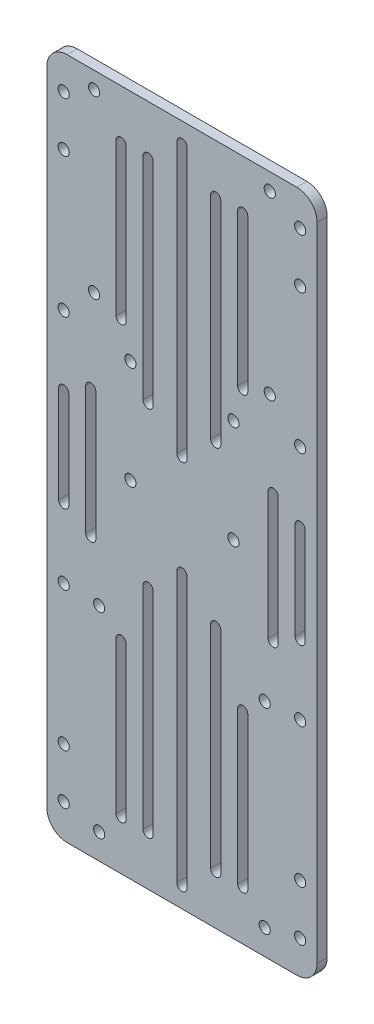
from build123d import *

# Parameters (mm, degrees)
SKETCH_1_R          = 1.65
EXTRUDE_1_DEPTH     = 3
SKETCH_3_R          = 1.65
CUT_EXTRUDE_2_DEPTH = 109.673823895
SKETCH_4_R          = 1.65
CUT_EXTRUDE_3_DEPTH = 109.673823895
CUT_EXTRUDE_4_DEPTH = 109.673823895


with BuildPart() as part:
    # Эскиз1 → Бобышка-Вытянуть1 (new body)
    with BuildSketch(Plane.XY):
        with BuildLine():
            Line((-34, 101), (34, 101))
            ThreePointArc((34, 101), (38.242640687, 99.242640687), (40, 95))
            Line((40, 95), (40, -95))
            ThreePointArc((40, -95), (38.242640687, -99.242640687), (34, -101))
            Line((34, -101), (-34, -101))
            ThreePointArc((-34, -101), (-38.242640687, -99.242640687), (-40, -95))
            Line((-40, -95), (-40, 95))
            ThreePointArc((-40, 95), (-38.242640687, 99.242640687), (-34, 101))
        make_face()
        with Locations((-35, 91)):
            Circle(SKETCH_1_R, mode=Mode.SUBTRACT)
        with Locations((-35, 35)):
            Circle(SKETCH_1_R, mode=Mode.SUBTRACT)
        with Locations(Location((35, 35, 0), (0, 0, 180))):
            Circle(SKETCH_1_R, mode=Mode.SUBTRACT)
        with Locations(Location((35, 91, 0), (0, 0, 180))):
            Circle(SKETCH_1_R, mode=Mode.SUBTRACT)
        with Locations((35, -91)):
            Circle(SKETCH_1_R, mode=Mode.SUBTRACT)
        with Locations(Location((-35, -91, 0), (0, 0, 180))):
            Circle(SKETCH_1_R, mode=Mode.SUBTRACT)
        with Locations(Location((-35, -35, 0), (0, 0, 180))):
            Circle(SKETCH_1_R, mode=Mode.SUBTRACT)
        with Locations((35, -35)):
            Circle(SKETCH_1_R, mode=Mode.SUBTRACT)
    extrude(amount=EXTRUDE_1_DEPTH)

    # Эскиз3 → Вырез-Вытянуть2 (cut, through all)
    with BuildSketch(Plane.XY.offset(3)):
        with Locations((-24.5, -93.5)):
            Circle(SKETCH_3_R)
        with Locations((-24.5, -35.5)):
            Circle(SKETCH_3_R)
        with Locations((-15.25, 1.25)):
            Circle(SKETCH_3_R)
        with Locations((-15.25, 31.75)):
            Circle(SKETCH_3_R)
        with Locations((-26, 44)):
            Circle(SKETCH_3_R)
        with Locations((-26, 96)):
            Circle(SKETCH_3_R)
        with Locations(Location((24.5, -93.5, 0), (0, 0, 180))):
            Circle(SKETCH_3_R)
        with Locations(Location((24.5, -35.5, 0), (0, 0, 180))):
            Circle(SKETCH_3_R)
        with Locations(Location((15.25, 1.25, 0), (0, 0, 180))):
            Circle(SKETCH_3_R)
        with Locations(Location((15.25, 31.75, 0), (0, 0, 180))):
            Circle(SKETCH_3_R)
        with Locations(Location((26, 44, 0), (0, 0, 180))):
            Circle(SKETCH_3_R)
        with Locations(Location((26, 96, 0), (0, 0, 180))):
            Circle(SKETCH_3_R)
    extrude(amount=-CUT_EXTRUDE_2_DEPTH, mode=Mode.SUBTRACT)

    # Эскиз4 → Вырез-Вытянуть3 (cut, through all)
    with BuildSketch(Plane.XY.offset(3)):
        with Locations((-35, 76.19)):
            Circle(SKETCH_4_R)
        with Locations(Location((35, 76.19, 0), (0, 0, 180))):
            Circle(SKETCH_4_R)
        with Locations((35, -76.19)):
            Circle(SKETCH_4_R)
        with Locations(Location((-35, -76.19, 0), (0, 0, 180))):
            Circle(SKETCH_4_R)
    extrude(amount=-CUT_EXTRUDE_3_DEPTH, mode=Mode.SUBTRACT)

    # Эскиз5 → Вырез-Вытянуть4 (cut, through all)
    with BuildSketch(Plane.XY.offset(3)):
        with BuildLine():
            Line((-33.5, 14.365), (-33.5, -14.365))
            ThreePointArc((-33.5, -14.365), (-35, -15.865), (-36.5, -14.365))
            Line((-36.5, -14.365), (-36.5, 14.365))
            ThreePointArc((-36.5, 14.365), (-35, 15.865), (-33.5, 14.365))
        make_face()
        with BuildLine():
            Line((-25.49, 18.895), (-25.49, -18.895))
            ThreePointArc((-25.49, -18.895), (-26.99, -20.395), (-28.49, -18.895))
            Line((-28.49, -18.895), (-28.49, 18.895))
            ThreePointArc((-28.49, 18.895), (-26.99, 20.395), (-25.49, 18.895))
        make_face()
        with BuildLine():
            Line((-16.5, -41.32), (-16.5, -86.32))
            ThreePointArc((-16.5, -86.32), (-18, -87.82), (-19.5, -86.32))
            Line((-19.5, -86.32), (-19.5, -41.32))
            ThreePointArc((-19.5, -41.32), (-18, -39.82), (-16.5, -41.32))
        make_face()
        with BuildLine():
            Line((-8.5, -23.74), (-8.5, -86.32))
            ThreePointArc((-8.5, -86.32), (-10, -87.82), (-11.5, -86.32))
            Line((-11.5, -86.32), (-11.5, -23.74))
            ThreePointArc((-11.5, -23.74), (-10, -22.24), (-8.5, -23.74))
        make_face()
        with BuildLine():
            Line((1.5, -15.03), (1.5, -95.03))
            ThreePointArc((1.5, -95.03), (0, -96.53), (-1.5, -95.03))
            Line((-1.5, -95.03), (-1.5, -15.03))
            ThreePointArc((-1.5, -15.03), (0, -13.53), (1.5, -15.03))
        make_face()
        with BuildLine():
            Line((8.5, -23.74), (8.5, -86.32))
            ThreePointArc((8.5, -86.32), (10, -87.82), (11.5, -86.32))
            Line((11.5, -86.32), (11.5, -23.74))
            ThreePointArc((11.5, -23.74), (10, -22.24), (8.5, -23.74))
        make_face()
        with BuildLine():
            Line((16.5, -41.32), (16.5, -86.32))
            ThreePointArc((16.5, -86.32), (18, -87.82), (19.5, -86.32))
            Line((19.5, -86.32), (19.5, -41.32))
            ThreePointArc((19.5, -41.32), (18, -39.82), (16.5, -41.32))
        make_face()
        with BuildLine():
            Line((25.49, 18.895), (25.49, -18.895))
            ThreePointArc((25.49, -18.895), (26.99, -20.395), (28.49, -18.895))
            Line((28.49, -18.895), (28.49, 18.895))
            ThreePointArc((28.49, 18.895), (26.99, 20.395), (25.49, 18.895))
        make_face()
        with BuildLine():
            Line((33.5, 14.365), (33.5, -14.365))
            ThreePointArc((33.5, -14.365), (35, -15.865), (36.5, -14.365))
            Line((36.5, -14.365), (36.5, 14.365))
            ThreePointArc((36.5, 14.365), (35, 15.865), (33.5, 14.365))
        make_face()
        with BuildLine():
            Line((-16.5, 41.32), (-16.5, 86.32))
            ThreePointArc((-16.5, 86.32), (-18, 87.82), (-19.5, 86.32))
            Line((-19.5, 86.32), (-19.5, 41.32))
            ThreePointArc((-19.5, 41.32), (-18, 39.82), (-16.5, 41.32))
        make_face()
        with BuildLine():
            Line((-8.5, 23.74), (-8.5, 86.32))
            ThreePointArc((-8.5, 86.32), (-10, 87.82), (-11.5, 86.32))
            Line((-11.5, 86.32), (-11.5, 23.74))
            ThreePointArc((-11.5, 23.74), (-10, 22.24), (-8.5, 23.74))
        make_face()
        with BuildLine():
            Line((8.5, 23.74), (8.5, 86.32))
            ThreePointArc((8.5, 86.32), (10, 87.82), (11.5, 86.32))
            Line((11.5, 86.32), (11.5, 23.74))
            ThreePointArc((11.5, 23.74), (10, 22.24), (8.5, 23.74))
        make_face()
        with BuildLine():
            Line((16.5, 41.32), (16.5, 86.32))
            ThreePointArc((16.5, 86.32), (18, 87.82), (19.5, 86.32))
            Line((19.5, 86.32), (19.5, 41.32))
            ThreePointArc((19.5, 41.32), (18, 39.82), (16.5, 41.32))
        make_face()
        with BuildLine():
            Line((1.5, 15.03), (1.5, 95.03))
            ThreePointArc((1.5, 95.03), (0, 96.53), (-1.5, 95.03))
            Line((-1.5, 95.03), (-1.5, 15.03))
            ThreePointArc((-1.5, 15.03), (0, 13.53), (1.5, 15.03))
        make_face()
    extrude(amount=-CUT_EXTRUDE_4_DEPTH, mode=Mode.SUBTRACT)


solid = part.part
